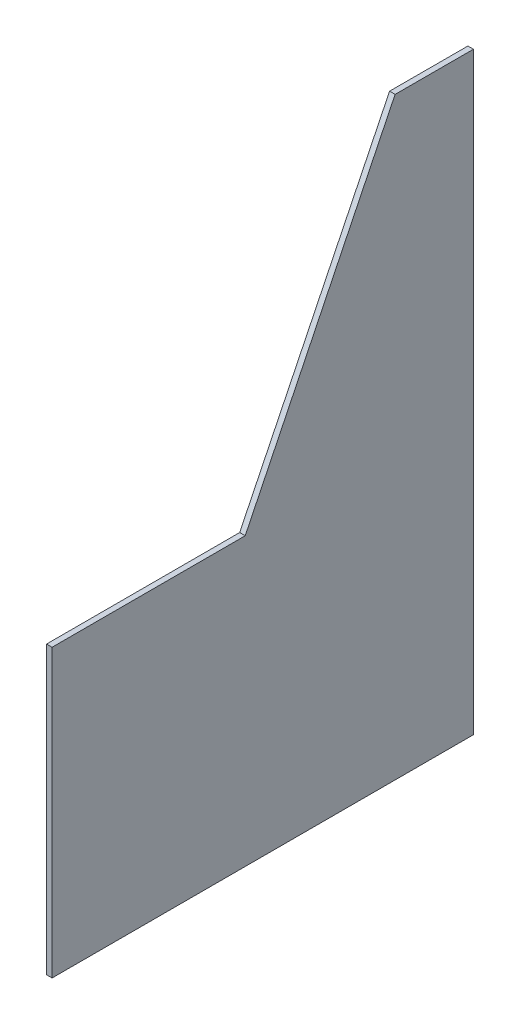
from build123d import *

# Parameters (mm, degrees)
EXTRUDE_1_DEPTH = 6


with BuildPart() as part:
    # Эскиз1 → Бобышка-Вытянуть1 (new body)
    with BuildSketch(Plane(origin=(0, 0, 0), x_dir=(0, 0, -1), z_dir=(1, 0, 0))):
        Polygon((456, 642.5), (371.197324312, 642.553801489), (209, 310.000004359), (0, 310), (0, 0), (456, 0), align=None)
    extrude(amount=EXTRUDE_1_DEPTH)


solid = part.part
